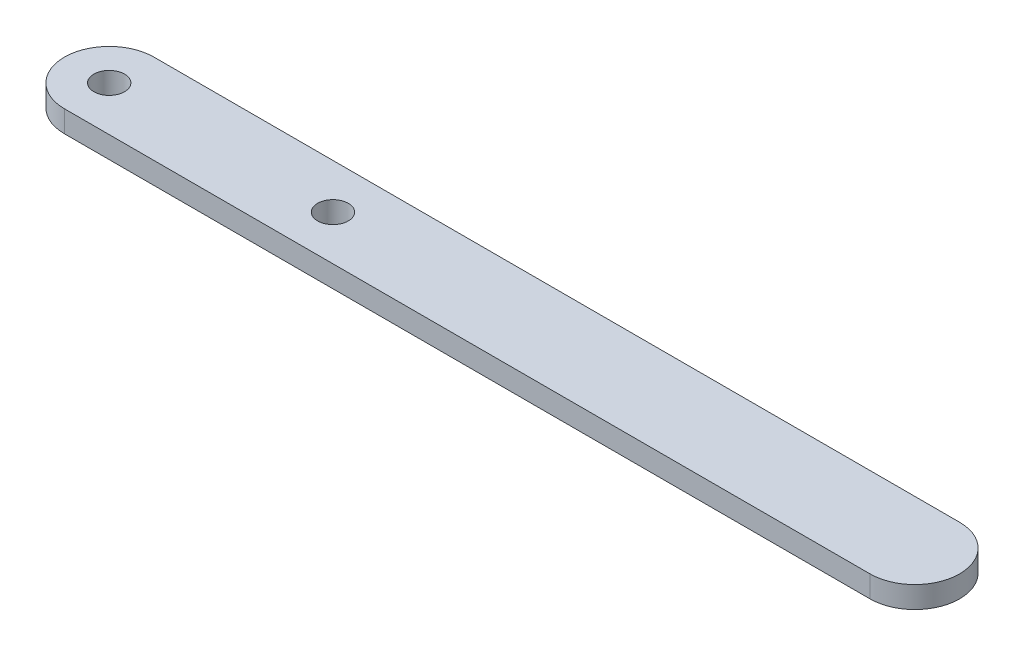
from build123d import *

# Parameters (mm, degrees)
BOSS_EXTRUDE1_DEPTH = 3.075
SKETCH2_R           = 2.175
CUT_EXTRUDE2_DEPTH  = 6.35


with BuildPart() as part:
    # Sketch1 → Boss-Extrude1 (new body)
    with BuildSketch(Plane(origin=(0, 0, 0), x_dir=(1, 0, 0), z_dir=(0, 1, 0))):
        with BuildLine():
            Line((-100.944661922, 8.700177936), (13.355338078, 8.700177936))
            ThreePointArc((13.355338078, 8.700177936), (19.705338078, 2.350177936), (13.355338078, -3.999822064))
            Line((13.355338078, -3.999822064), (-100.944661922, -3.999822064))
            ThreePointArc((-100.944661922, -3.999822064), (-107.294661922, 2.350177936), (-100.944661922, 8.700177936))
        make_face()
    extrude(amount=BOSS_EXTRUDE1_DEPTH)

    # Sketch2 → Cut-Extrude2 (cut)
    with BuildSketch(Plane(origin=(0, 3.075, 0), x_dir=(1, 0, 0), z_dir=(0, 1, 0))):
        with Locations(Location((-100.944661922, 2.350177936, 0), (0, 0, 270))):
            Circle(SKETCH2_R)
        with Locations(Location((-69.194661922, 2.350177936, 0), (0, 0, 270))):
            Circle(SKETCH2_R)
    extrude(amount=-CUT_EXTRUDE2_DEPTH, mode=Mode.SUBTRACT)


solid = part.part
